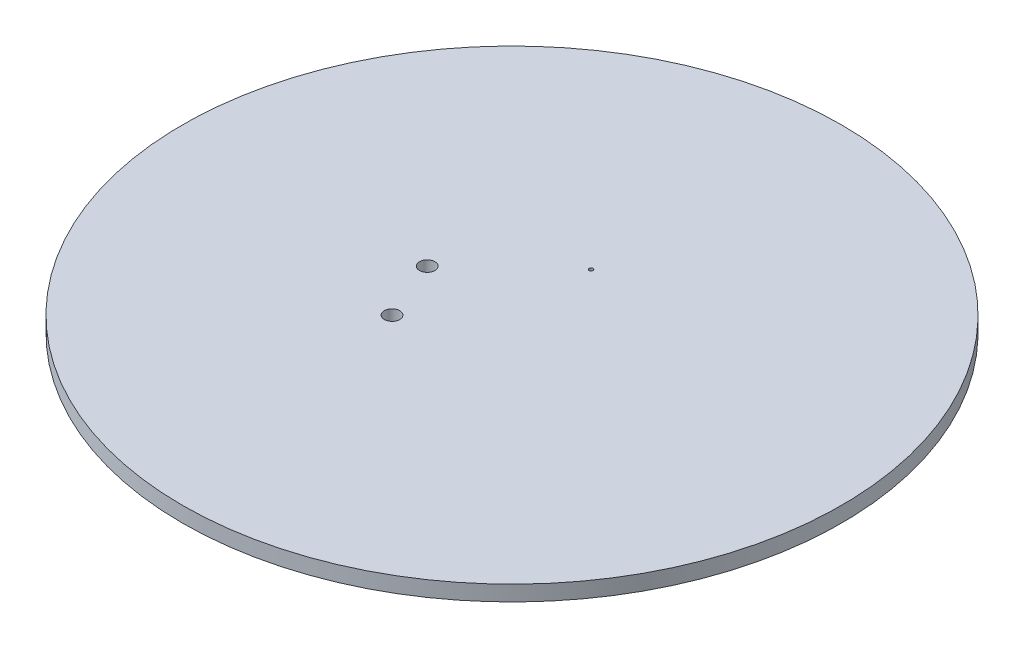
from build123d import *

# Parameters (mm, degrees)
SKETCH1_R               = 42.73
BOSS_EXTRUDE1_DEPTH     = 2
CUT_EXTRUDE1_DEPTH      = 61.462432965
CUT_EXTRUDE1_DEPTH_BACK = 61.462432965
SKETCH2_R               = 0.25
CUT_EXTRUDE2_DEPTH      = 61.462432965
CUT_EXTRUDE2_DEPTH_BACK = 61.462432965
SKETCH3_R               = 1


with BuildPart() as part:
    # Sketch1 → Boss-Extrude1 (new body)
    with BuildSketch(Plane(origin=(0, 0, 0), x_dir=(1, 0, 0), z_dir=(0, 1, 0))):
        with Locations(Location((0, 0, 0), (0, 0, 270))):
            Circle(SKETCH1_R)
    extrude(amount=BOSS_EXTRUDE1_DEPTH)

    # Sketch2 → Cut-Extrude1 (cut, two sides: drawn at the far end of the back side and taken through both)
    with BuildSketch(Plane(origin=(0, 2, 0), x_dir=(1, 0, 0), z_dir=(0, 1, 0)).offset(-CUT_EXTRUDE1_DEPTH_BACK)):
        with Locations(Location((0, 10.25, 0), (0, 0, 270))):
            Circle(SKETCH2_R)
    extrude(amount=CUT_EXTRUDE1_DEPTH + CUT_EXTRUDE1_DEPTH_BACK, mode=Mode.SUBTRACT)

    # Sketch3 → Cut-Extrude2 (cut, two sides: drawn at the far end of the back side and taken through both)
    with BuildSketch(Plane(origin=(0, 2, 0), x_dir=(1, 0, 0), z_dir=(0, 1, 0)).offset(-CUT_EXTRUDE2_DEPTH_BACK)):
        with Locations(Location((-11, 0, 0), (0, 0, 270))):
            Circle(SKETCH3_R)
        with Locations(Location((-7.778174593, -7.778174593, 0), (0, 0, 270))):
            Circle(SKETCH3_R)
    extrude(amount=CUT_EXTRUDE2_DEPTH + CUT_EXTRUDE2_DEPTH_BACK, mode=Mode.SUBTRACT)


solid = part.part
